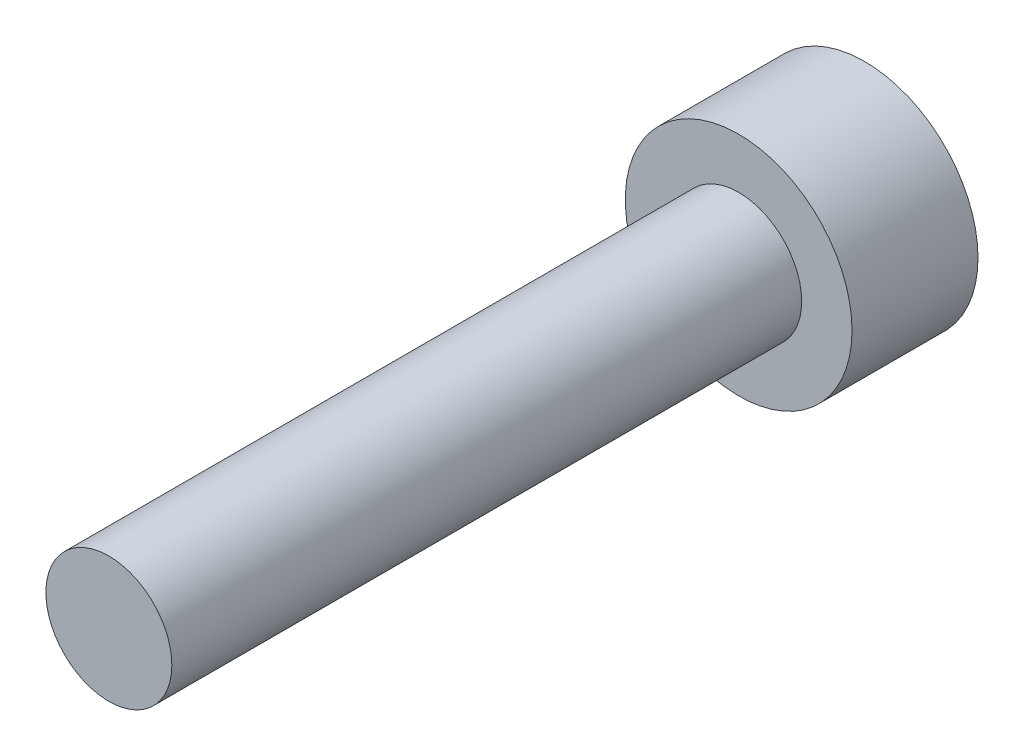
from build123d import *

# Parameters (mm, degrees)
SKETCH_1_R          = 3.6
EXTRUDE_1_DEPTH     = 4
SKETCH_2_R          = 2
EXTRUDE_2_DEPTH     = 20
CUT_EXTRUDE_1_DEPTH = 2


with BuildPart() as part:
    # 草图1 → 凸台-拉伸1 (new body)
    with BuildSketch(Plane.XY):
        Circle(SKETCH_1_R)
    extrude(amount=EXTRUDE_1_DEPTH)

    # 草图2 → 凸台-拉伸2 (add)
    with BuildSketch(Plane.XY.offset(4)):
        Circle(SKETCH_2_R)
    extrude(amount=EXTRUDE_2_DEPTH)

    # 草图3 → 切除-拉伸1 (cut)
    with BuildSketch(Plane(origin=(0, 0, 0), x_dir=(-1, 0, 0), z_dir=(0, 0, -1))):
        Polygon((1.247264865, 1.267463486), (-0.474023145, 1.713894802), (-1.72128801, 0.446431315), (-1.247264865, -1.267463486), (0.474023145, -1.713894802), (1.72128801, -0.446431315), align=None)
    extrude(amount=-CUT_EXTRUDE_1_DEPTH, mode=Mode.SUBTRACT)


solid = part.part
